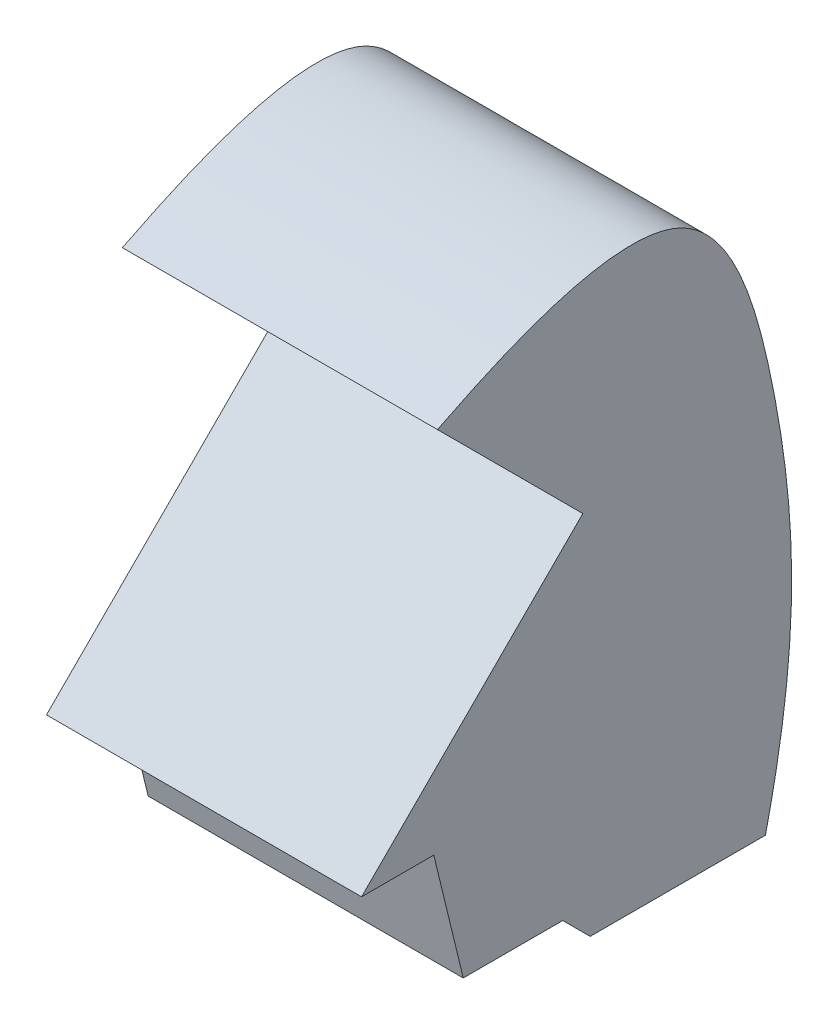
from build123d import *

# Parameters (mm, degrees)
BOSS_EXTRUDE1_DEPTH = 24
SKETCH11_R          = 5.697753685
CUT_EXTRUDE4_DEPTH  = 7
SCALE1_SCALE        = 10


with BuildPart() as part:
    # Sketch2 → Boss-Extrude1 (new body)
    with BuildSketch(Plane(origin=(0, 0, 0), x_dir=(0, 0, -1), z_dir=(1, 0, 0))):
        with BuildLine():
            Line((-32.984771151, 37.156853259), (-21.910488843, 26.082570951))
            Line((-21.910488843, 26.082570951), (-38.764900737, 9.228159057))
            Line((-38.764900737, 9.228159057), (-33.264173814, 9.228159057))
            Line((-33.264173814, 9.228159057), (-31.019846879, 0))
            Line((-31.019846879, 0), (-23.440853259, 0))
            Line((-23.440853259, 0), (-21.34974547, -2.091107789))
            Line((-21.34974547, -2.091107789), (-8.002162552, -2.091107789))
            add(Edge.make_bspline(
                [(-32.984771151, 37.156853259), (-28.59740608, 39.351452903), (-12.654264242, 47.061104602), (-5.191801864, 21.120328129), (-5.563958224, 8.398722741), (-8.002162552, -2.091107789)],
                knots=[0, 0, 0, 0, 0.297117955, 0.53565113, 1, 1, 1, 1], degree=3))
        make_face()
    extrude(amount=-BOSS_EXTRUDE1_DEPTH)

    # Sketch11 → Cut-Extrude4 (cut)
    with BuildSketch(Plane(origin=(0, 1.148199013, -4.721131737), x_dir=(-1, 0, 0), z_dir=(0, 0.23631575032824995, -0.9716763175804979))):
        with Locations((11.664383963, 22.358606811)):
            Circle(SKETCH11_R)
    extrude(amount=-CUT_EXTRUDE4_DEPTH, mode=Mode.SUBTRACT)

    # Sketch67 → Revolve1 (revolve)
    with BuildSketch(Plane(origin=(0, -0.269695489, 1.108926168), x_dir=(1, 0, 0), z_dir=(0, -0.23631575032824995, 0.9716763175804979))):
        with BuildLine():
            Line((-11.664383963, 29.106819343), (-11.664383963, 16.034921428))
            add(Edge.make_bspline(
                [(-10.249978258, 16.385269123), (-10.936701733, 16.123637578), (-11.664383963, 16.034921428)],
                knots=[0, 0, 0, 1, 1, 1], degree=2))
            add(Edge.make_bspline(
                [(-9.952034037, 28.848556307), (-5.742682801, 26.309194224), (-2.240550386, 18.762433328), (-10.249978258, 16.385269123)],
                knots=[0, 0, 0, 0, 1, 1, 1, 1], degree=3))
            add(Edge.make_bspline(
                [(-9.952034037, 28.848556307), (-10.775072134, 29.212627771), (-11.664383963, 29.106819343)],
                knots=[0, 0, 0, 1, 1, 1], degree=2))
        make_face()
    revolve(axis=Axis((-11.664383963, 21.455633243, 6.392617113), (0, 0.9716763175804978, 0.23631575032824992)))


with BuildPart() as part_1:
    # Scale1: scaled about (0, 0, 0)
    add(part.part.scale(SCALE1_SCALE))


solid = part_1.part
